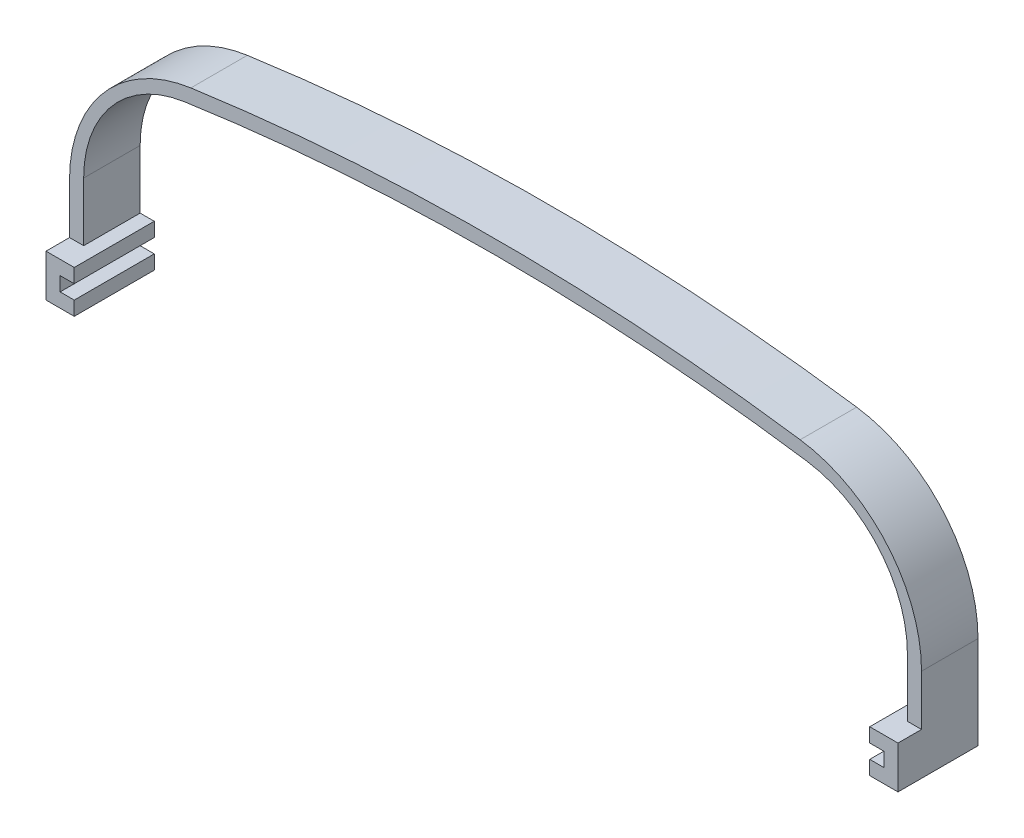
from build123d import *

# Parameters (mm, degrees)
BOSS_EXTRUDE1_DEPTH = 12
BOSS_EXTRUDE2_DEPTH = 5
FILLET1_R           = 25
FILLET2_R           = 30


with BuildPart() as part:
    # Sketch1 → Boss-Extrude1 (new body)
    with BuildSketch(Plane.XY):
        with BuildLine():
            Line((84.5, 0), (87.5, 0))
            Line((87.5, 0), (87.5, 3))
            Line((87.5, 3), (84.5, 3))
            Line((84.5, 3), (84.5, 6))
            Line((84.5, 6), (87.5, 6))
            Line((87.5, 6), (87.5, 39.535975243))
            ThreePointArc((87.5, 39.535975243), (43.954208317, 45.879066954), (0, 48))
            Line((0, 48), (0, 51))
            ThreePointArc((0, 51), (45.473206397, 48.744464323), (90.5, 42))
            Line((90.5, 42), (90.5, -3))
            Line((90.5, -3), (84.5, -3))
            Line((84.5, -3), (84.5, 0))
        make_face()
    boss_extrude1 = extrude(amount=BOSS_EXTRUDE1_DEPTH)

    # Sketch2 → Boss-Extrude2 (add)
    with BuildSketch(Plane.XY.offset(12)):
        Polygon((90.5, -3), (84.5, -3), (84.5, 0), (87.5, 0), (87.5, 3), (84.5, 3), (84.5, 6), (90.5, 6), align=None)
    boss_extrude2 = extrude(amount=BOSS_EXTRUDE2_DEPTH)

    # Mirror1: Boss-Extrude1, Boss-Extrude2 across plane
    add(boss_extrude1.mirror(Plane(origin=(0, 0, 0), x_dir=(0, 0, 1), z_dir=(1, 0, 0))))
    add(boss_extrude2.mirror(Plane(origin=(0, 0, 0), x_dir=(0, 0, 1), z_dir=(1, 0, 0))))

    # Fillet1
    fillet1_edges = [part.edges().sort_by_distance(p)[0] for p in [
        (87.5, 39.535975243, 6),
        (-87.5, 39.535975243, 6),
    ]]
    fillet(fillet1_edges, radius=FILLET1_R)

    # Fillet2
    fillet2_edges = [part.edges().sort_by_distance(p)[0] for p in [
        (90.5, 42, 6),
        (-90.5, 42, 6),
    ]]
    fillet(fillet2_edges, radius=FILLET2_R)


solid = part.part
